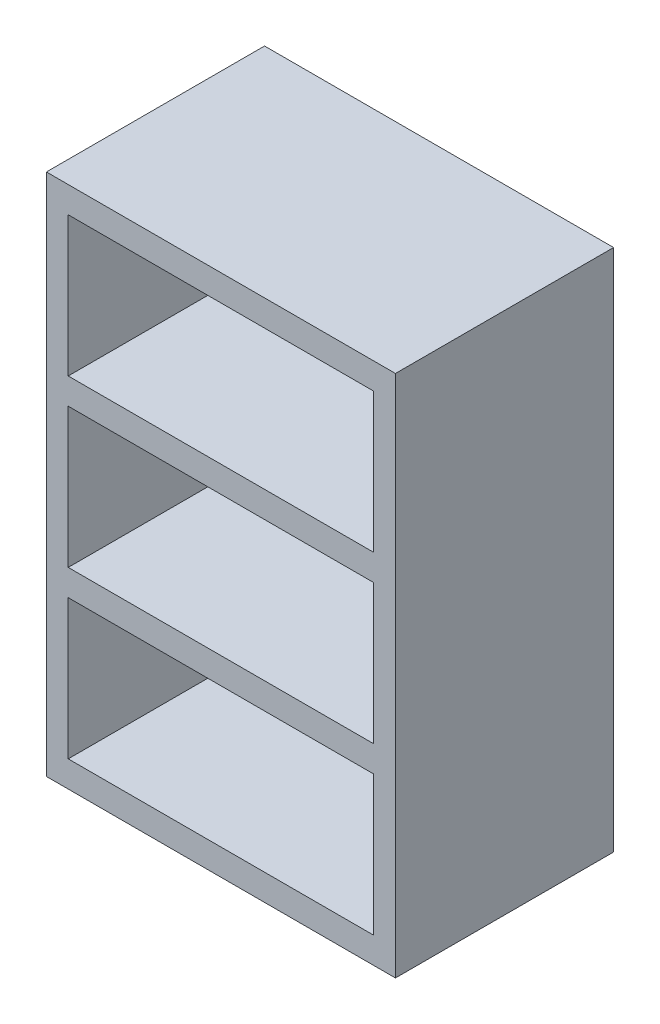
from build123d import *

# Parameters (mm, degrees)
SKETCH1_W           = 800
SKETCH1_H           = 1200
BOSS_EXTRUDE1_DEPTH = 500
SKETCH2_W           = 700
SKETCH2_H           = 320
CUT_EXTRUDE1_DEPTH  = 400


with BuildPart() as part:
    # Sketch1 → Boss-Extrude1 (new body)
    with BuildSketch(Plane.XY):
        Rectangle(SKETCH1_W, SKETCH1_H)
    extrude(amount=BOSS_EXTRUDE1_DEPTH)

    # Sketch2 → Cut-Extrude1 (cut)
    with BuildSketch(Plane.XY.offset(500)):
        with Locations((0, 380)):
            Rectangle(SKETCH2_W, SKETCH2_H)
        Rectangle(SKETCH2_W, SKETCH2_H)
        with Locations((0, -380)):
            Rectangle(SKETCH2_W, SKETCH2_H)
    extrude(amount=-CUT_EXTRUDE1_DEPTH, mode=Mode.SUBTRACT)


solid = part.part
